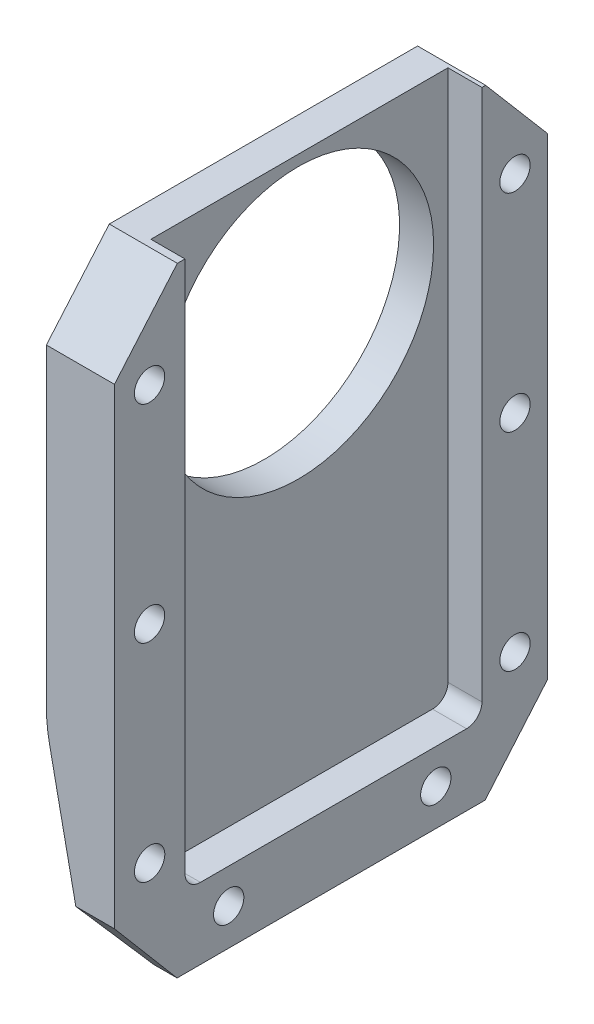
from build123d import *

# Parameters (mm, degrees)
BOSS_EXTRUDE1_DEPTH                   = 35.56
FILLET1_R                             = 12.7
SKETCH6_W                             = 24.384
SKETCH6_H                             = 44.958
CUT_EXTRUDE1_DEPTH                    = 2.794
FILLET2_R                             = 1.27
CUT_EXTRUDE3_DEPTH                    = 63.260576162
CUT_EXTRUDE4_DEPTH                    = 63.260576162
F_7_8_0_875_DIAMETER_HOLE1_D          = 22.225
F_40_0_098_DIAMETER_HOLE1_D           = 2.4892
F_40_0_098_DIAMETER_HOLE1_CSINK_D     = 3.7592
F_40_0_098_DIAMETER_HOLE1_CSINK_ANGLE = 90


with BuildPart() as part:
    # Sketch1 → Boss-Extrude1 (new body)
    with BuildSketch(Plane.XY):
        Polygon((0, 0), (0, 50.8), (-5.588, 50.8), (-5.588, 17.78), (-1.916643762, 0), align=None)
    extrude(amount=BOSS_EXTRUDE1_DEPTH)

    # Fillet1
    fillet1_edges = [part.edges().sort_by_distance(p)[0] for p in [
        (-5.588, 17.78, 17.78),
    ]]
    fillet(fillet1_edges, radius=FILLET1_R)

    # Sketch6 → Cut-Extrude1 (cut)
    with BuildSketch(Plane(origin=(0, 0, 0), x_dir=(0, 0, -1), z_dir=(1, 0, 0))):
        with Locations((-17.580042727, 28.321)):
            Rectangle(SKETCH6_W, SKETCH6_H)
    extrude(amount=-CUT_EXTRUDE1_DEPTH, mode=Mode.SUBTRACT)

    # Fillet2
    fillet2_edges = [part.edges().sort_by_distance(p)[0] for p in [
        (-1.397, 5.842, 29.772042727),
        (-1.397, 5.842, 5.388042727),
    ]]
    fillet(fillet2_edges, radius=FILLET2_R)

    # Sketch10 → Cut-Extrude3 (cut, through all)
    with BuildSketch(Plane(origin=(0, 0, 0), x_dir=(0, 0, -1), z_dir=(1, 0, 0))):
        Polygon((-35.56, 44.780420684), (-30.397580851, 50.8), (-35.56, 50.8), align=None)
    extrude(amount=-CUT_EXTRUDE3_DEPTH, mode=Mode.SUBTRACT)

    # Sketch11 → Cut-Extrude4 (cut, through all)
    with BuildSketch(Plane(origin=(0, 0, 0), x_dir=(0, 0, -1), z_dir=(1, 0, 0))):
        Polygon((-5.085545117, 50.8), (0, 50.8), (0, 44.824895363), align=None)
        Polygon((0, 6.029531172), (-5.128692816, 0), (0, 0), align=None)
        Polygon((-35.56, 6.07121688), (-35.56, 0), (-30.417091858, 0), align=None)
    extrude(amount=-CUT_EXTRUDE4_DEPTH, mode=Mode.SUBTRACT)

    # 7/8 (0.875) Diameter Hole1 (through all)
    with Locations(Plane.ZY.offset(5.588)):
        with Locations((17.678535919, 38.809523369)):
            Hole(F_7_8_0_875_DIAMETER_HOLE1_D / 2)

    # #40 (0.098) Diameter Hole1 (through all)
    with Locations(Plane.ZY.offset(5.588)):
        with Locations((2.678535919, 43.309523369), (2.678535919, 26.309523369), (2.678535919, 9.309523369), (9.178535919, 3.009523369), (26.181895158, 2.999179942), (32.672942909, 9.299179942), (32.678535919, 26.309523369), (32.678535919, 43.299179942)):
            CounterSinkHole(F_40_0_098_DIAMETER_HOLE1_D / 2, F_40_0_098_DIAMETER_HOLE1_CSINK_D / 2, counter_sink_angle=F_40_0_098_DIAMETER_HOLE1_CSINK_ANGLE)


solid = part.part
